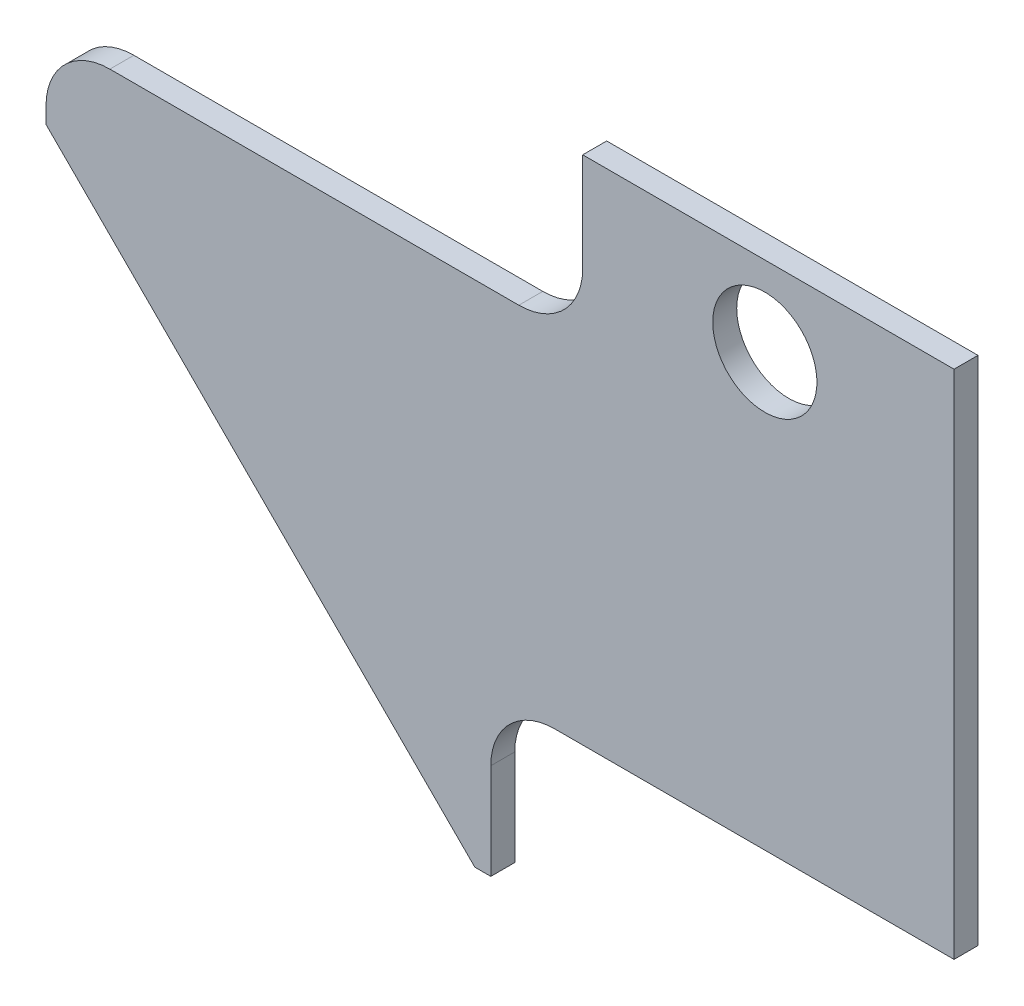
from build123d import *

# Parameters (mm, degrees)
SKETCH1_R           = 20.701
BOSS_EXTRUDE1_DEPTH = 9.525
SKETCH2_W           = 184.15
SKETCH2_H           = 63.5
SKETCH2_W_2         = 213.36
SKETCH2_H_2         = 64.479988722
CUT_EXTRUDE1_DEPTH  = 267.045158533
FILLET1_R           = 25.4
FILLET2_R           = 25.4


with BuildPart() as part:
    # Sketch1 → Boss-Extrude1 (new body)
    with BuildSketch(Plane.XY):
        Polygon((-138.259383474, 48.991487021), (32.210627804, -121.478524257), (222.710627804, -121.478524257), (222.710627804, 145.221475743), (-138.259383474, 145.221475743), align=None)
        with Locations(Location((147.490616526, 113.471475743, 0), (0, 0, 180))):
            Circle(SKETCH1_R, mode=Mode.SUBTRACT)
    extrude(amount=BOSS_EXTRUDE1_DEPTH)

    # Sketch2 → Cut-Extrude1 (cut, through all)
    with BuildSketch(Plane.XY.offset(9.525)):
        with Locations((130.635627804, -89.728524257)):
            Rectangle(SKETCH2_W, SKETCH2_H)
        with Locations((-31.579383474, 112.981481382)):
            Rectangle(SKETCH2_W_2, SKETCH2_H_2)
    extrude(amount=-CUT_EXTRUDE1_DEPTH, mode=Mode.SUBTRACT)

    # Fillet1
    fillet1_edges = [part.edges().sort_by_distance(p)[0] for p in [
        (75.100616526, 80.741487021, 4.7625),
    ]]
    fillet(fillet1_edges, radius=FILLET1_R)

    # Fillet2
    fillet2_edges = [part.edges().sort_by_distance(p)[0] for p in [
        (38.560627804, -57.978524257, 4.7625),
        (-138.259383474, 80.741487021, 4.7625),
    ]]
    fillet(fillet2_edges, radius=FILLET2_R)


solid = part.part
